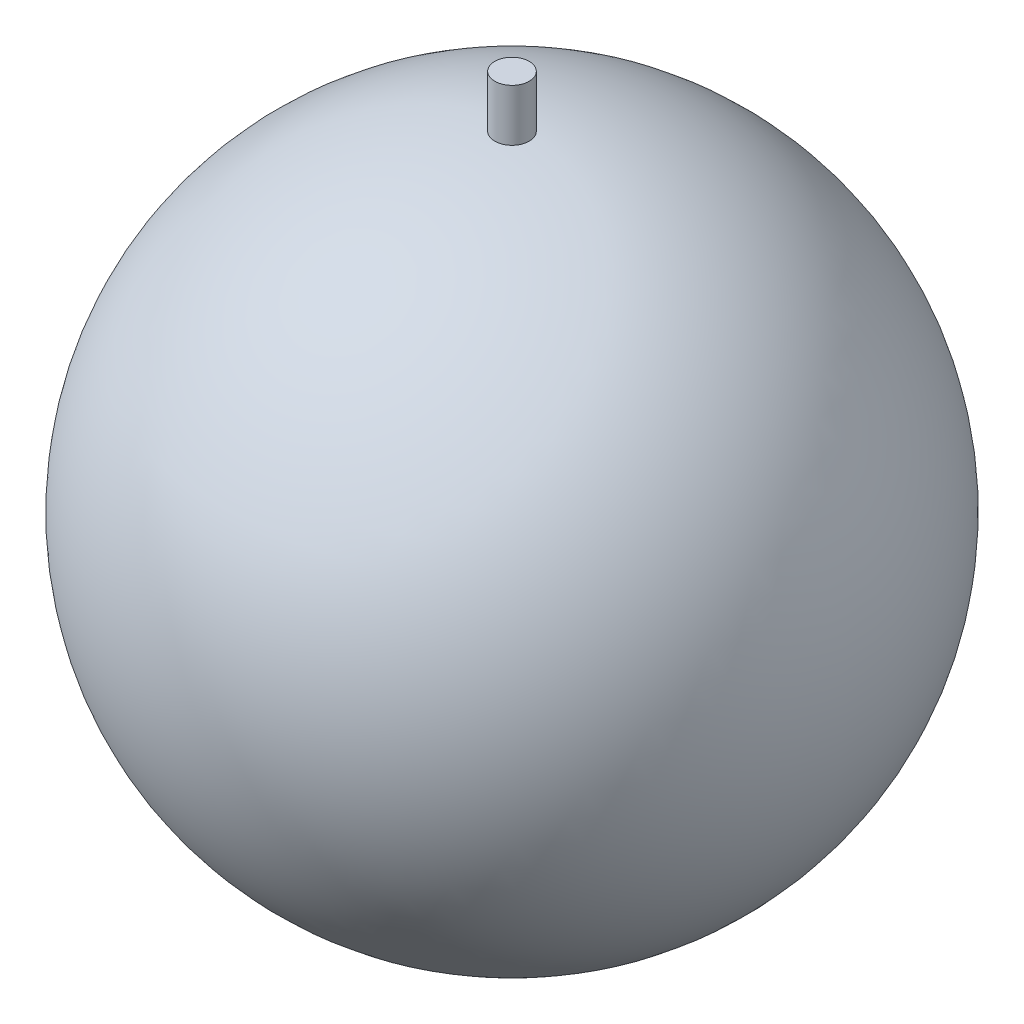
from build123d import *

# Parameters (mm, degrees)
SKETCH3_R           = 1.657311133
BOSS_EXTRUDE1_DEPTH = 5


with BuildPart() as part:
    # Sketch2 → Revolve6 (revolve)
    with BuildSketch(Plane.XY):
        with BuildLine():
            Line((14.520682521, 55.156064241), (14.520682521, -8.324959104))
            ThreePointArc((14.520682521, -8.324959104), (-17.219829152, 23.415552568), (14.520682521, 55.156064241))
        make_face()
    revolve(axis=Axis((14.520682521, 55.156064241, 0), (0, -1, 0)))


with BuildPart() as body_2:
    # Sketch3 → Boss-Extrude1 (new body)
    with BuildSketch(Plane(origin=(0, 55.156064241, 0), x_dir=(1, 0, 0), z_dir=(0, 1, 0))):
        with Locations((14.520682521, 0)):
            Circle(SKETCH3_R)
    extrude(amount=BOSS_EXTRUDE1_DEPTH)


solid = Compound([part.part, body_2.part])
